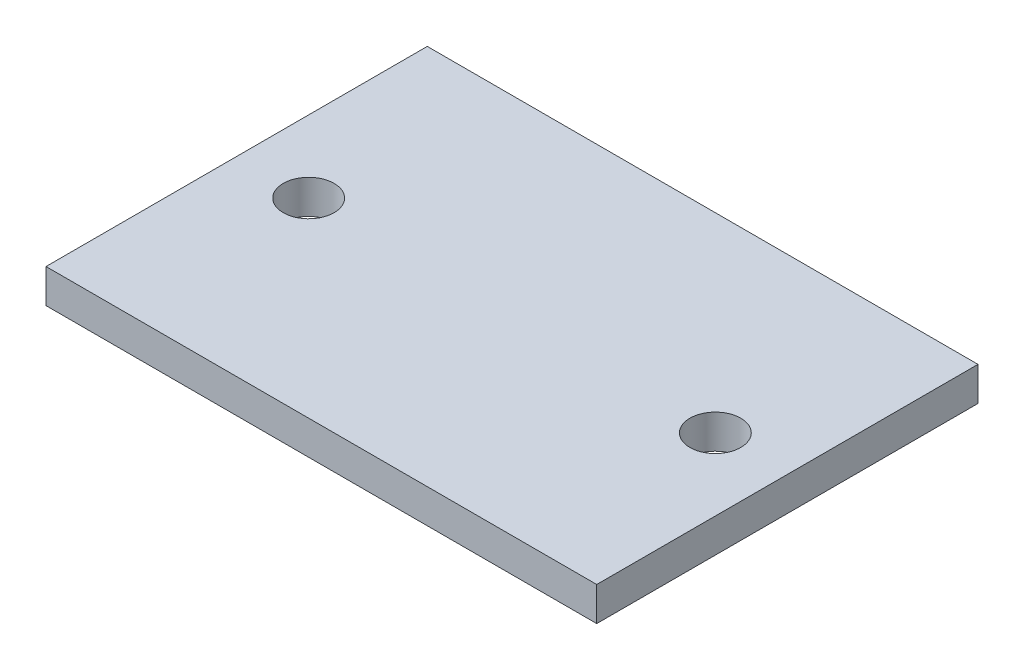
from build123d import *

# Parameters (mm, degrees)
SKETCH1_W               = 65
SKETCH1_H               = 45
BOSS_EXTRUDE1_DEPTH     = 4
CUT_EXTRUDE1_DEPTH      = 40.730341051
CUT_EXTRUDE1_DEPTH_BACK = 40.730341051
SKETCH2_R               = 3


with BuildPart() as part:
    # Sketch1 → Boss-Extrude1 (new body)
    with BuildSketch(Plane(origin=(0, 0, 0), x_dir=(1, 0, 0), z_dir=(0, 1, 0))):
        Rectangle(SKETCH1_W, SKETCH1_H)
    extrude(amount=BOSS_EXTRUDE1_DEPTH)

    # Sketch2 → Cut-Extrude1 (cut, two sides: drawn at the far end of the back side and taken through both)
    with BuildSketch(Plane(origin=(0, 4, 0), x_dir=(1, 0, 0), z_dir=(0, 1, 0)).offset(-CUT_EXTRUDE1_DEPTH_BACK)):
        with Locations(Location((-24, 0, 0), (0, 0, 270))):
            Circle(SKETCH2_R)
        with Locations(Location((24, 0, 0), (0, 0, 270))):
            Circle(SKETCH2_R)
    extrude(amount=CUT_EXTRUDE1_DEPTH + CUT_EXTRUDE1_DEPTH_BACK, mode=Mode.SUBTRACT)


solid = part.part
